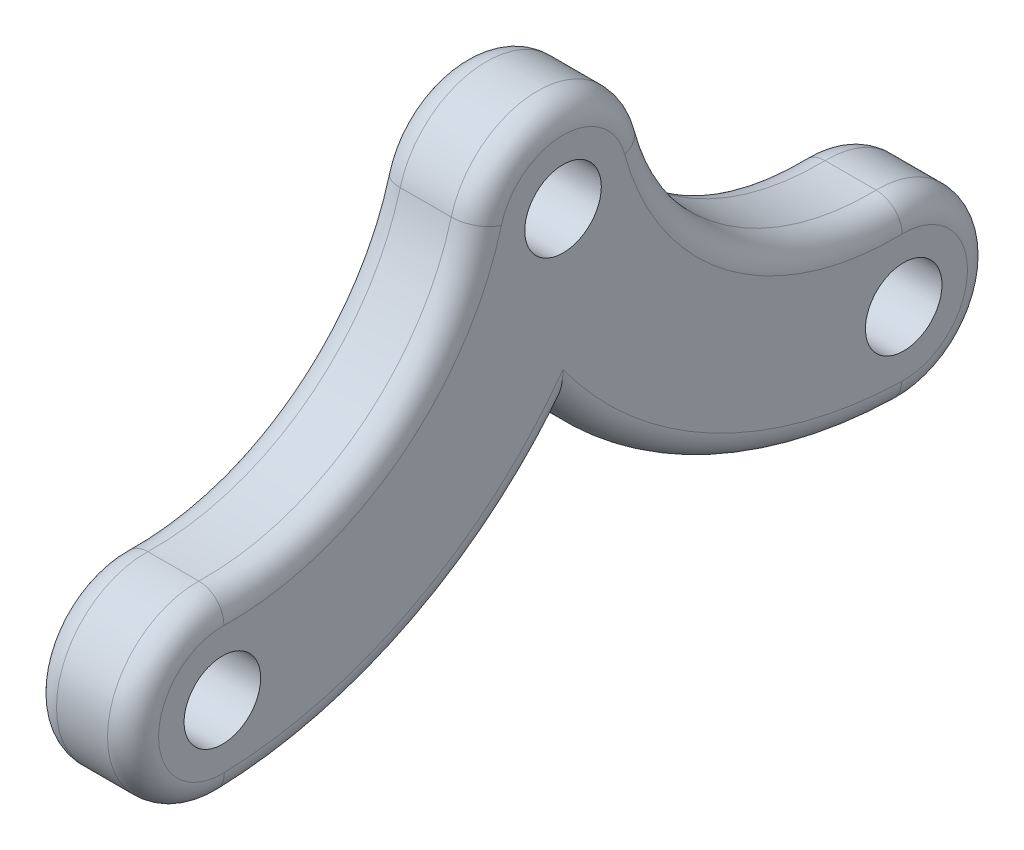
from build123d import *

# Parameters (mm, degrees)
SKETCH1_R           = 15
BOSS_EXTRUDE1_DEPTH = 40
FILLET1_R           = 10


with BuildPart() as part:
    # Sketch1 → Boss-Extrude1 (new body)
    with BuildSketch(Plane(origin=(0, 0, 0), x_dir=(0, 0, -1), z_dir=(1, 0, 0))):
        with BuildLine():
            ThreePointArc((132.694646831, -65.009266851), (168.499781041, -100.12380247), (132.447129149, -134.984160172))
            ThreePointArc((132.447129149, -134.984160172), (59.3634858, -117.047102518), (0, -70.79849696))
            ThreePointArc((0, -70.79849696), (-59.3634858, -117.047102518), (-132.447129149, -134.984160172))
            ThreePointArc((-132.447129149, -134.984160172), (-168.499781041, -100.12380247), (-132.694646831, -65.009266851))
            ThreePointArc((-132.694646831, -65.009266851), (-70.44161018, -45.071700409), (-33.805757942, 9.064807223))
            ThreePointArc((-33.805757942, 9.064807223), (0, 35), (33.805757942, 9.064807223))
            ThreePointArc((33.805757942, 9.064807223), (70.44161018, -45.071700409), (132.694646831, -65.009266851))
        make_face()
        Circle(SKETCH1_R, mode=Mode.SUBTRACT)
        with Locations((-133.5, -100)):
            Circle(SKETCH1_R, mode=Mode.SUBTRACT)
        with Locations((133.5, -100)):
            Circle(SKETCH1_R, mode=Mode.SUBTRACT)
    extrude(amount=BOSS_EXTRUDE1_DEPTH)

    # Fillet1
    fillet1_edges = [part.edges().sort_by_distance(p)[0] for p in [
        (0, -117.047102518, -59.3634858),
        (0, -117.047102518, 59.3634858),
        (0, -100.12380247, 168.499781041),
        (0, -45.071700409, 70.44161018),
        (0, 35, 0),
        (0, -45.071700409, -70.44161018),
        (0, -100.12380247, -168.499781041),
        (40, -100.12380247, -168.499781041),
        (40, -45.071700409, -70.44161018),
        (40, 35, 0),
        (40, -45.071700409, 70.44161018),
        (40, -100.12380247, 168.499781041),
        (40, -117.047102518, 59.3634858),
        (40, -117.047102518, -59.3634858),
    ]]
    fillet(fillet1_edges, radius=FILLET1_R)


solid = part.part
